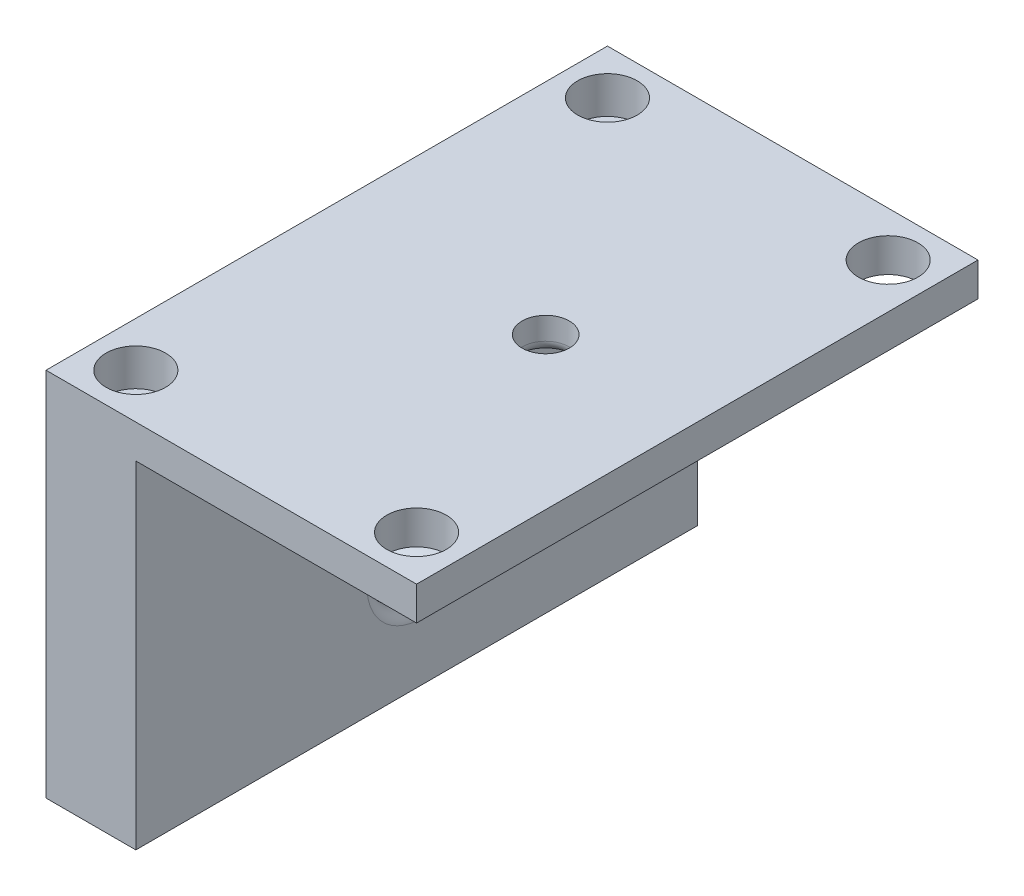
from build123d import *

# Parameters (mm, degrees)
SKETCH1_W           = 25
SKETCH1_H           = 50
SKETCH1_R           = 2.1
BOSS_EXTRUDE1_DEPTH = 3
SKETCH2_W           = 50
SKETCH2_H           = 3
BOSS_EXTRUDE2_DEPTH = 8
SKETCH3_W           = 8
SKETCH3_H           = 50
BOSS_EXTRUDE3_DEPTH = 30
SKETCH4_R           = 2.65
CUT_EXTRUDE1_DEPTH  = 3.3
FILLET1_R           = 1
SKETCH5_R           = 3.868246804
CUT_EXTRUDE2_DEPTH  = 9
FILLET2_R           = 1


with BuildPart() as part:
    # Sketch1 → Boss-Extrude1 (new body)
    with BuildSketch(Plane(origin=(0, 0, 0), x_dir=(1, 0, 0), z_dir=(0, 1, 0))):
        with Locations((2.276951673, 11.384758364)):
            Rectangle(SKETCH1_W, SKETCH1_H)
        with Locations(Location((1.276951673, 11.384758364, 0), (0, 0, 270))):
            Circle(SKETCH1_R, mode=Mode.SUBTRACT)
    extrude(amount=BOSS_EXTRUDE1_DEPTH)

    # Sketch2 → Boss-Extrude2 (add)
    with BuildSketch(Plane.ZY.offset(10.223048327)):
        with Locations((-11.384758364, 1.5)):
            Rectangle(SKETCH2_W, SKETCH2_H)
    extrude(amount=BOSS_EXTRUDE2_DEPTH)

    # Sketch3 → Boss-Extrude3 (add)
    with BuildSketch(Plane.XZ):
        with Locations((-14.223048327, -11.384758364)):
            Rectangle(SKETCH3_W, SKETCH3_H)
    extrude(amount=BOSS_EXTRUDE3_DEPTH)

    # Sketch4 → Cut-Extrude1 (cut)
    with BuildSketch(Plane(origin=(0, 3, 0), x_dir=(1, 0, 0), z_dir=(0, 1, 0))):
        with Locations(Location((-14.223048327, 32.384758364, 0), (0, 0, 270))):
            Circle(SKETCH4_R)
        with Locations(Location((-14.223048327, -9.615241636, 0), (0, 0, 270))):
            Circle(SKETCH4_R)
    cut_extrude1 = extrude(amount=-CUT_EXTRUDE1_DEPTH, mode=Mode.SUBTRACT)

    # Mirror1: Cut-Extrude1 across plane
    add(cut_extrude1.mirror(Plane.ZX.offset(-13.5)), mode=Mode.SUBTRACT)

    # Fillet1
    fillet1_edges = [part.edges().sort_by_distance(p)[0] for p in [
        (1.276951673, 0, -13.484758364),
    ]]
    fillet(fillet1_edges, radius=FILLET1_R)

    # Sketch5 → Cut-Extrude2 (cut)
    with BuildSketch(Plane.ZY.offset(18.223048327)):
        with Locations((-11.836279124, -20)):
            Circle(SKETCH5_R)
    extrude(amount=-CUT_EXTRUDE2_DEPTH, mode=Mode.SUBTRACT)

    # Fillet2
    fillet2_edges = [part.edges().sort_by_distance(p)[0] for p in [
        (-10.223048327, -20, -15.704525928),
    ]]
    fillet(fillet2_edges, radius=FILLET2_R)

    # Mirror2: Cut-Extrude1 across plane
    add(cut_extrude1.mirror(Plane.ZY.offset(1.723048327)), mode=Mode.SUBTRACT)


solid = part.part
